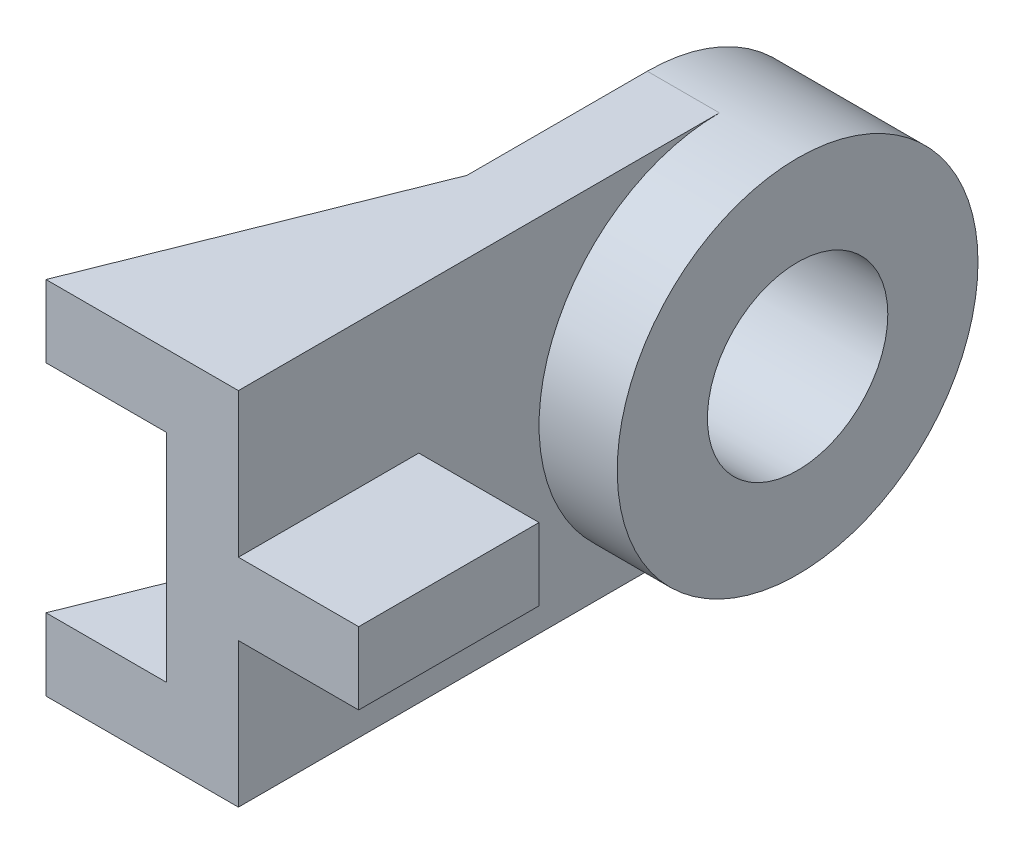
from build123d import *

# Parameters (mm, degrees)
BOSS_EXTRUDE1_DEPTH     = 12
BOSS_EXTRUDE2_DEPTH     = 25
SKETCH2_W               = 20
SKETCH2_H               = 30
BOSS_EXTRUDE3_DEPTH     = 6
BOSS_EXTRUDE4_DEPTH     = 12
CUT_EXTRUDE1_DEPTH      = 97.566039579
CUT_EXTRUDE1_DEPTH_BACK = 97.566039579
SKETCH4_R               = 15


with BuildPart() as part:
    # Sketch1 → Boss-Extrude1 (new body)
    with BuildSketch(Plane.YZ):
        with BuildLine():
            Line((-30, 80), (-30, 0))
            ThreePointArc((-30, 0), (0, 30), (30, 0))
            Line((30, 0), (30, 80))
            Line((30, 80), (-30, 80))
        make_face()
    extrude(amount=BOSS_EXTRUDE1_DEPTH)

    # Sketch1<3> → Boss-Extrude2 (add)
    with BuildSketch(Plane.YZ):
        with BuildLine():
            ThreePointArc((30, 0), (0, 30), (-30, 0))
            ThreePointArc((-30, 0), (0, -30), (30, 0))
        make_face()
    extrude(amount=BOSS_EXTRUDE2_DEPTH)

    # Sketch2 → Boss-Extrude3 (add, symmetric)
    with BuildSketch(Plane(origin=(0, 0, 0), x_dir=(-1, 0, 0), z_dir=(0, 1, 0))):
        with Locations((-22, 65)):
            Rectangle(SKETCH2_W, SKETCH2_H)
    extrude(amount=BOSS_EXTRUDE3_DEPTH, both=True)

    # Sketch3 → Boss-Extrude4 (add)
    with BuildSketch(Plane(origin=(0, 30, 0), x_dir=(-1, 0, 0), z_dir=(0, 1, 0))):
        Polygon((0, 80), (20, 80), (0, 30), align=None)
    boss_extrude4 = extrude(amount=-BOSS_EXTRUDE4_DEPTH)

    # Mirror1: Boss-Extrude4 across plane
    add(boss_extrude4.mirror(Plane.ZX))

    # Sketch4 → Cut-Extrude1 (cut, two sides: drawn at the far end of the back side and taken through both)
    with BuildSketch(Plane.YZ.offset(25).offset(-CUT_EXTRUDE1_DEPTH_BACK)):
        Circle(SKETCH4_R)
    extrude(amount=CUT_EXTRUDE1_DEPTH + CUT_EXTRUDE1_DEPTH_BACK, mode=Mode.SUBTRACT)


solid = part.part
